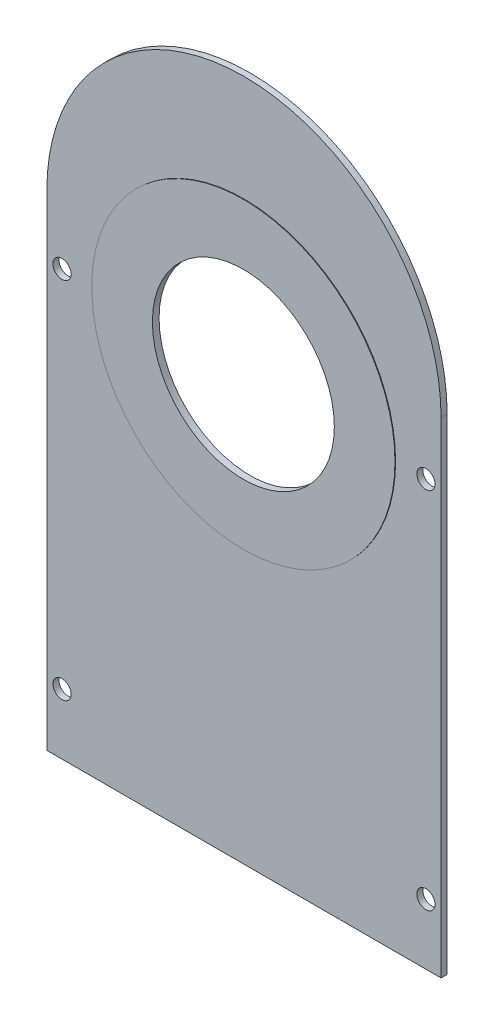
from build123d import *

# Parameters (mm, degrees)
SKETCH1_R           = 1.5
SKETCH1_R_2         = 15
BOSS_EXTRUDE1_DEPTH = 1
SKETCH2_R           = 25
BOSS_EXTRUDE2_DEPTH = 0.1
SKETCH3_R           = 15
CUT_EXTRUDE1_DEPTH  = 1


with BuildPart() as part:
    # Sketch1 → Boss-Extrude1 (new body)
    with BuildSketch(Plane.XY):
        with BuildLine():
            Line((-32.5, 40), (-32.5, -40))
            Line((-32.5, -40), (32.5, -40))
            Line((32.5, -40), (32.5, 40))
            ThreePointArc((32.5, 40), (0, 72.5), (-32.5, 40))
        make_face()
        with Locations((-30, -30)):
            Circle(SKETCH1_R, mode=Mode.SUBTRACT)
        with Locations((-30, 30)):
            Circle(SKETCH1_R, mode=Mode.SUBTRACT)
        with Locations((30, -30)):
            Circle(SKETCH1_R, mode=Mode.SUBTRACT)
        with Locations((30, 30)):
            Circle(SKETCH1_R, mode=Mode.SUBTRACT)
        with Locations((0, 30)):
            Circle(SKETCH1_R_2, mode=Mode.SUBTRACT)
    extrude(amount=BOSS_EXTRUDE1_DEPTH)

    # Sketch2 → Boss-Extrude2 (add)
    with BuildSketch(Plane.XY.offset(1)):
        with Locations((0, 30)):
            Circle(SKETCH2_R)
    extrude(amount=BOSS_EXTRUDE2_DEPTH)

    # Sketch3 → Cut-Extrude1 (cut)
    with BuildSketch(Plane(origin=(0, 0, 1), x_dir=(-1, 0, 0), z_dir=(0, 0, -1))):
        with Locations(Location((0, 30, 0), (0, 0, 180))):
            Circle(SKETCH3_R)
    extrude(amount=-CUT_EXTRUDE1_DEPTH, mode=Mode.SUBTRACT)


solid = part.part
